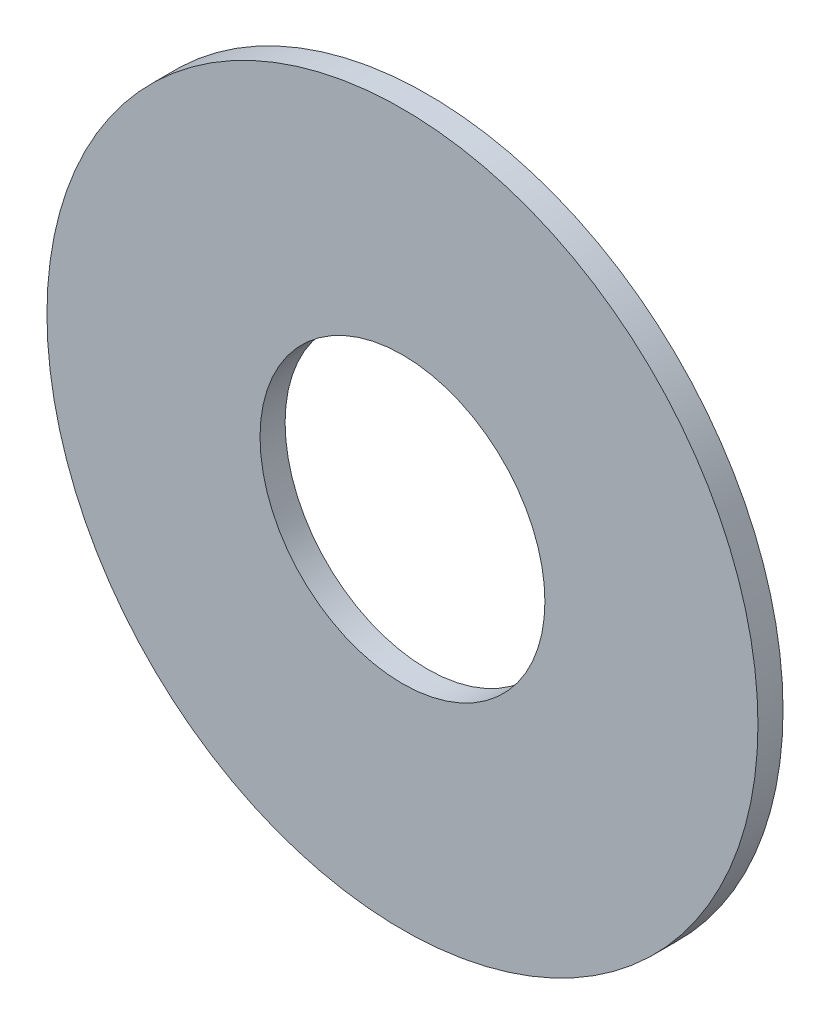
from build123d import *

# Parameters (mm, degrees)
SKETCH2_R           = 11.2522
SKETCH2_R_2         = 4.5085
BOSS_EXTRUDE1_DEPTH = 0.79375


with BuildPart() as part:
    # Sketch2 → Boss-Extrude1 (new body)
    with BuildSketch(Plane.XY):
        Circle(SKETCH2_R)
        Circle(SKETCH2_R_2, mode=Mode.SUBTRACT)
    extrude(amount=BOSS_EXTRUDE1_DEPTH)


solid = part.part
